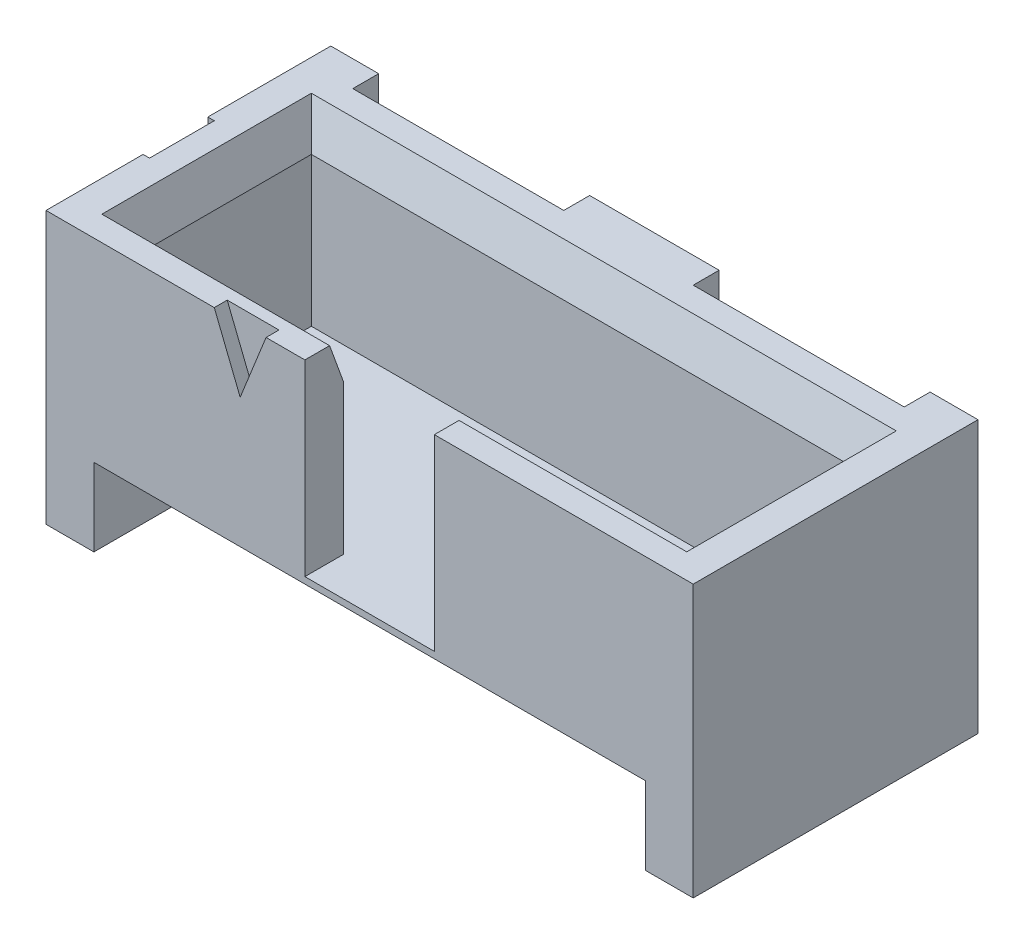
from build123d import *

# Parameters (mm, degrees)
SKETCH1_W               = 12.7
SKETCH1_H               = 5.334
BOSS_EXTRUDE1_DEPTH     = 5.588
CUT_EXTRUDE1_DEPTH      = 5.4102
CUT_EXTRUDE1_DEPTH_BACK = 5.4102
SKETCH3_W               = 10.922
SKETCH3_H               = 3.556
CUT_EXTRUDE2_DEPTH      = 0.762
CUT_EXTRUDE2_DRAFT      = -20
SKETCH4_W               = 2.54
SKETCH4_H               = 3.683
CUT_EXTRUDE3_DEPTH      = 2.54
CUT_EXTRUDE4_DEPTH      = 0.254
SKETCH6_W               = 10.922
SKETCH6_H               = 3.556
CUT_EXTRUDE5_DEPTH      = 3.683
SKETCH7_W               = 13.716
SKETCH7_H               = 6.35
CUT_EXTRUDE6_DEPTH      = 5.334


with BuildPart() as part:
    # Sketch1 → Boss-Extrude1 (new body)
    with BuildSketch(Plane.XY.offset(-3.048)):
        with Locations((0, 2.667)):
            Rectangle(SKETCH1_W, SKETCH1_H)
    extrude(amount=BOSS_EXTRUDE1_DEPTH)

    # Sketch2 → Cut-Extrude1 (cut, two sides: drawn at the far end of the back side and taken through both)
    with BuildSketch(Plane(origin=(0, 0, 0), x_dir=(0, 0, -1), z_dir=(1, 0, 0)).offset(-CUT_EXTRUDE1_DEPTH_BACK)):
        Polygon((-2.54, 1.524), (-2.54, 0), (3.048, 0), (3.048, 2.032), (1.524, 0.508), (-1.524, 0.508), align=None)
    extrude(amount=CUT_EXTRUDE1_DEPTH + CUT_EXTRUDE1_DEPTH_BACK, mode=Mode.SUBTRACT)


with BuildPart() as cut_extrude2_tool:
    # Sketch3 → Cut-Extrude2 (with draft: the straight prism first)
    with BuildSketch(Plane(origin=(0, 4.572, 0), x_dir=(1, 0, 0), z_dir=(0, 1, 0))):
        Rectangle(SKETCH3_W, SKETCH3_H)
    extrude(amount=CUT_EXTRUDE2_DEPTH)
    # Cut-Extrude2: the draft: its side faces are tilted about the plane it starts from
    cut_extrude2_sides = [cut_extrude2_tool.faces().sort_by_distance(p)[0] for p in [
        (-5.461, 4.953, 0),
        (0, 4.953, 1.778),
        (5.461, 4.953, 0),
        (0, 4.953, -1.778),
    ]]
    draft(cut_extrude2_sides, Plane(origin=(0, 4.572, 0), x_dir=(1, 0, 0), z_dir=(0, 1, 0)), CUT_EXTRUDE2_DRAFT)


with BuildPart() as part_1:
    add(part.part)

    # Cut-Extrude2: cut by cut_extrude2_tool
    add(cut_extrude2_tool.part, mode=Mode.SUBTRACT)

    # Sketch4 → Cut-Extrude3 (cut)
    with BuildSketch(Plane.XY):
        with Locations((0, 3.4925)):
            Rectangle(SKETCH4_W, SKETCH4_H)
    extrude(amount=CUT_EXTRUDE3_DEPTH, mode=Mode.SUBTRACT)

    # Sketch5 → Cut-Extrude4 (cut)
    with BuildSketch(Plane.XY.offset(2.54)):
        Polygon((-3.048, 5.334), (-2.54, 4.064), (-2.032, 5.334), align=None)
    extrude(amount=-CUT_EXTRUDE4_DEPTH, mode=Mode.SUBTRACT)

    # Sketch6 → Cut-Extrude5 (cut)
    with BuildSketch(Plane(origin=(0, 5.334, 0), x_dir=(1, 0, 0), z_dir=(0, 1, 0))):
        Rectangle(SKETCH6_W, SKETCH6_H)
    extrude(amount=-CUT_EXTRUDE5_DEPTH, mode=Mode.SUBTRACT)

    # Sketch7 → Cut-Extrude6 (cut)
    with BuildSketch(Plane(origin=(0, 0, 0), x_dir=(1, 0, 0), z_dir=(0, 1, 0))):
        with Locations((0, 0.127)):
            Rectangle(SKETCH7_W, SKETCH7_H)
        Polygon((-6.604, -0.635), (-6.604, -2.794), (6.604, -2.794), (6.604, 3.048), (5.4102, 3.048), (5.4102, 2.54), (1.27, 2.54), (1.27, 3.048), (-1.27, 3.048), (-1.27, 2.54), (-5.4102, 2.54), (-5.4102, 3.048), (-6.604, 3.048), (-6.604, 0.635), (-6.223, 0.635), (-6.223, -0.635), align=None, mode=Mode.SUBTRACT)
    extrude(amount=CUT_EXTRUDE6_DEPTH, mode=Mode.SUBTRACT)


solid = part_1.part
